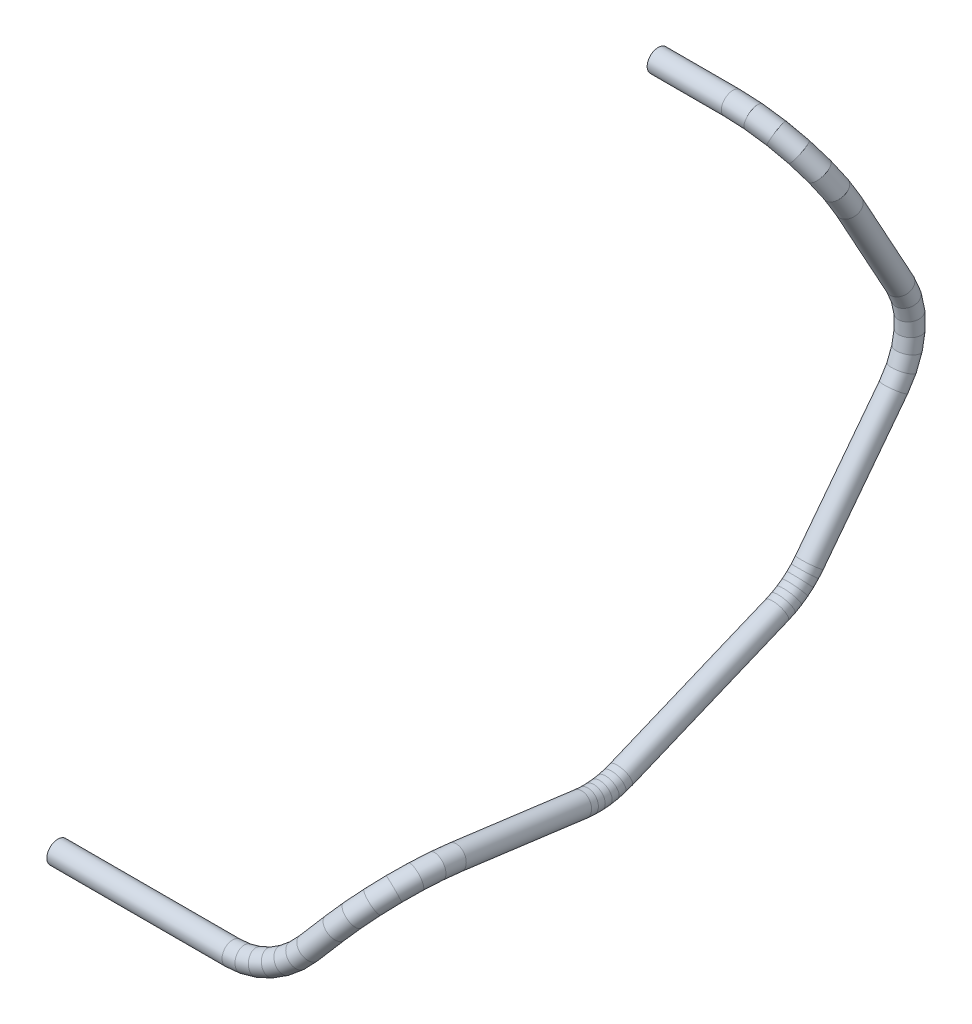
from build123d import *

# Parameters (mm, degrees)
PROFILE_R   = 2.5
PROFILE_R_2 = 1


with BuildPart() as part:
    # Tube: sweep along a curve in space
    with BuildLine() as tube_path:
        Line((-571, -108.371069164, 44.888766616), (-531.067063489, -108.371069164, 44.888766616))
        Line((-531.067063489, -108.371069164, 44.888766616), (-528.278596322, -108.170310961, 44.805609846))
        Line((-528.278596322, -108.170310961, 44.805609846), (-525.55745487, -107.57288353, 44.558147302))
        Line((-525.55745487, -107.57288353, 44.558147302), (-522.969339315, -106.593211363, 44.152353804))
        Line((-522.969339315, -106.593211363, 44.152353804), (-520.576738012, -105.254948006, 43.598026971))
        Line((-520.576738012, -105.254948006, 43.598026971), (-518.437418755, -103.59040495, 42.908550662))
        Line((-518.437418755, -103.59040495, 42.908550662), (-516.603034008, -101.6397715, 42.100571832))
        Line((-516.603034008, -101.6397715, 42.100571832), (-512.675521506, -96.741231141, 40.071529979))
        Line((-512.675521506, -96.741231141, 40.071529979), (-510.323870163, -93.869720735, 38.389041622))
        Line((-510.323870163, -93.869720735, 38.389041622), (-508.209515795, -91.414134937, 35.917967542))
        Line((-508.209515795, -91.414134937, 35.917967542), (-506.440829525, -89.500334669, 32.784962511))
        Line((-506.440829525, -89.500334669, 32.784962511), (-505.108465275, -88.226411663, 29.150608538))
        Line((-505.108465275, -88.226411663, 29.150608538), (-504.280713305, -87.657660777, 25.201184248))
        Line((-504.280713305, -87.657660777, 25.201184248), (-504, -87.823233308, 21.139117177))
        Line((-504, -87.823233308, 21.139117177), (-504, -91.574833127, -7.357112577))
        Line((-504, -91.574833127, -7.357112577), (-504, -91.711693611, -8.921435065))
        Line((-504, -91.711693611, -8.921435065), (-504, -91.711693611, -10.49173301))
        Line((-504, -91.711693611, -10.49173301), (-504, -91.574833127, -12.056055497))
        Line((-504, -91.574833127, -12.056055497), (-504, -91.302153751, -13.602497088))
        Line((-504, -91.302153751, -13.602497088), (-504, -90.895730736, -15.119288428))
        Line((-504, -90.895730736, -15.119288428), (-504, -90.358657208, -16.59488582))
        Line((-504, -90.358657208, -16.59488582), (-504, -75.627575547, -52.158862954))
        Line((-504, -75.627575547, -52.158862954), (-504, -74.963938959, -53.58203621))
        Line((-504, -74.963938959, -53.58203621), (-504, -74.178789986, -54.941954122))
        Line((-504, -74.178789986, -54.941954122), (-504, -73.278104087, -56.228266894))
        Line((-504, -73.278104087, -56.228266894), (-504, -72.268736024, -57.431184909))
        Line((-504, -72.268736024, -57.431184909), (-504, -71.158367699, -58.541553234))
        Line((-504, -71.158367699, -58.541553234), (-504, -69.955449684, -59.550921297))
        Line((-504, -69.955449684, -59.550921297), (-504, -44.920404233, -78.760987317))
        Line((-504, -44.920404233, -78.760987317), (-504, -41.979189348, -80.596950428))
        Line((-504, -41.979189348, -80.596950428), (-504, -38.7405353, -81.834942955))
        Line((-504, -38.7405353, -81.834942955), (-504, -35.324607205, -82.429031152))
        Line((-504, -35.324607205, -82.429031152), (-504, -31.85814765, -82.357172319))
        Line((-504, -31.85814765, -82.357172319), (-504, -28.469774112, -81.622032664))
        Line((-504, -28.469774112, -81.622032664), (-504, -25.285206813, -80.250888377))
        Line((-504, -25.285206813, -80.250888377), (-504, -4.070261185, -68.577491697))
        Line((-504, -4.070261185, -68.577491697), (-504.613335127, 0.011382756, -66.331591582))
        Line((-504.613335127, 0.011382756, -66.331591582), (-506.411542732, 3.814869408, -64.238745849))
        Line((-506.411542732, 3.814869408, -64.238745849), (-509.272077939, 7.08099744, -62.441578474))
        Line((-509.272077939, 7.08099744, -62.441578474), (-513, 9.587185626, -61.062563446))
        Line((-513, 9.587185626, -61.062563446), (-517.341257188, 11.162641381, -60.195678359))
        Line((-517.341257188, 11.162641381, -60.195678359), (-522, 11.7, -59.9))
        Line((-522, 11.7, -59.9), (-538.85, 11.7, -59.9))
    # Profile → Tube (sweep)
    with BuildSketch(Plane(origin=(-571, 0, 0), x_dir=(0, 0, -1), z_dir=(1, 0, 0))):
        with Locations((-44.888766616, -108.371069164)):
            Circle(PROFILE_R)
        with Locations((-44.888766616, -108.371069164)):
            Circle(PROFILE_R_2, mode=Mode.SUBTRACT)
    sweep(path=tube_path.line, transition=Transition.RIGHT)


solid = part.part
